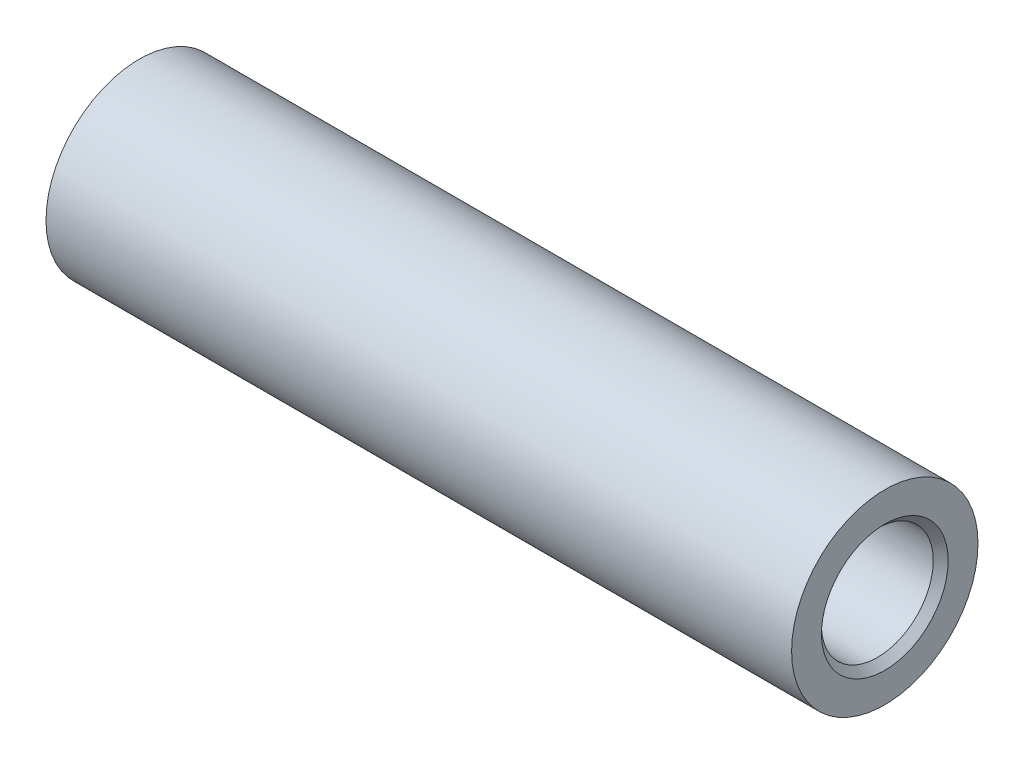
from build123d import *

# Parameters (mm, degrees)
EXTRUDE_1_DEPTH      = 19
EXTRUDE_1_DEPTH_BACK = 21
SKETCH_1_R           = 5
SKETCH_3_R           = 3
CUT_EXTRUDE_1_DEPTH  = 17
SKETCH_4_R           = 4
CUT_EXTRUDE_2_DEPTH  = 21
EXTRUDE_2_DEPTH      = 12
EXTRUDE_START        = 15
EXTRUDE_3_DEPTH      = 15
CHAMFER_1_SIZE       = 0.4


with BuildPart() as part:
    # 草图1 → 凸台-拉伸1 (new, two sides: drawn at the far end of the back side and taken through both)
    with BuildSketch(Plane(origin=(0, 0, 0), x_dir=(0, 0, -1), z_dir=(1, 0, 0)).offset(-EXTRUDE_1_DEPTH_BACK)):
        Circle(SKETCH_1_R)
    extrude(amount=EXTRUDE_1_DEPTH + EXTRUDE_1_DEPTH_BACK)

    # 草图3 → 切除-拉伸1 (cut)
    with BuildSketch(Plane(origin=(19, 0, 0), x_dir=(0, 0, -1), z_dir=(1, 0, 0))):
        Circle(SKETCH_3_R)
    extrude(amount=-CUT_EXTRUDE_1_DEPTH, mode=Mode.SUBTRACT)

    # 草图4 → 切除-拉伸2 (cut)
    with BuildSketch(Plane.ZY.offset(21)):
        Circle(SKETCH_4_R)
    extrude(amount=-CUT_EXTRUDE_2_DEPTH, mode=Mode.SUBTRACT)

    # 草图6 → 凸台-拉伸3 (add)
    with BuildSketch(Plane.ZY.offset(EXTRUDE_START)):
        with BuildLine():
            Line((-1.899540758, 3.520191033), (1.973227995, 3.479421113))
            ThreePointArc((1.973227995, 3.479421113), (0.042106993, 3.999778369), (-1.899540758, 3.520191033))
        make_face()
    extrude(amount=-EXTRUDE_3_DEPTH)

    # 倒角1
    chamfer_1_edges = [part.edges().sort_by_distance(p)[0] for p in [
        (-21, 0, -4),
        (19, 0, 3),
    ]]
    chamfer(chamfer_1_edges, length=CHAMFER_1_SIZE)


with BuildPart() as body_2:
    # 草图5 → 凸台-拉伸2 (new body)
    with BuildSketch(Plane(origin=(2, 0, 0), x_dir=(0, 0, -1), z_dir=(1, 0, 0))):
        with BuildLine():
            Line((-1.658312395, 2.5), (1.658312395, 2.5))
            ThreePointArc((1.658312395, 2.5), (0, 3), (-1.658312395, 2.5))
        make_face()
    extrude(amount=EXTRUDE_2_DEPTH)


solid = Compound([part.part, body_2.part])
